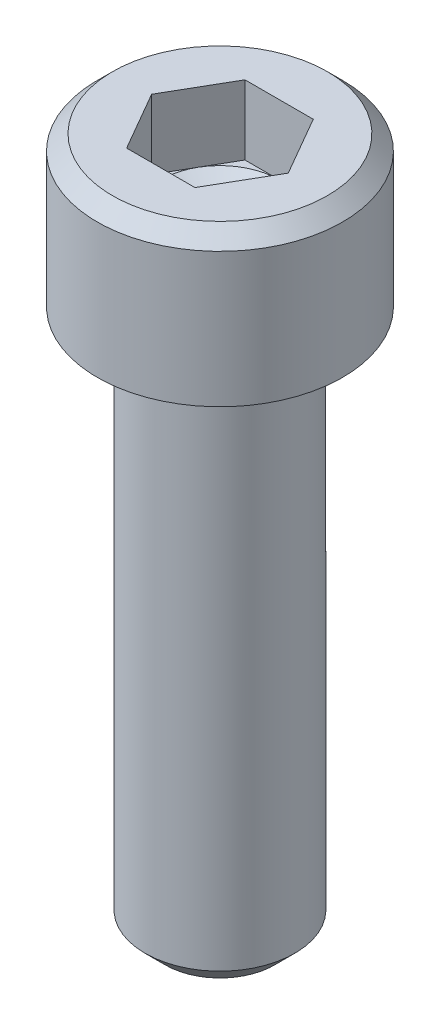
from build123d import *

# Parameters (mm, degrees)
SKETCH1_W           = 2.8702
SKETCH1_H           = 3.5052
SKETCH2_R           = 1.7526
BOSS_EXTRUDE1_DEPTH = 12.7
CUT_EXTRUDE1_DEPTH  = 1.6256
CHAMFER1_SIZE       = 0.47244
CHAMFER2_SIZE       = 0.3556
FILLET1_R           = 0.254


with BuildPart() as part:
    # Sketch1 → Revolve1 (revolve)
    with BuildSketch(Plane.XY, mode=Mode.PRIVATE) as revolve1_sk:
        with Locations((1.4351, 1.7526)):
            Rectangle(SKETCH1_W, SKETCH1_H)
    revolve(revolve1_sk.sketch.rotate(Axis((0, 3.5052, 0), (0, -1, 0)), 270), axis=Axis((0, 3.5052, 0), (0, -1, 0)))

    # Sketch2 → Boss-Extrude1 (add)
    with BuildSketch(Plane.XZ):
        with Locations(Location((0, 0, 0), (0, 0, 270))):
            Circle(SKETCH2_R)
    extrude(amount=BOSS_EXTRUDE1_DEPTH)

    # Sketch3 → Cut-Extrude1 (cut)
    with BuildSketch(Plane(origin=(0, 3.5052, 0), x_dir=(-1, 0, 0), z_dir=(0, 1, 0))):
        Polygon((-0.799225978, 1.3843), (-1.598451955, 0), (-0.799225978, -1.3843), (0.799225978, -1.3843), (1.598451955, 0), (0.799225978, 1.3843), align=None)
    extrude(amount=-CUT_EXTRUDE1_DEPTH, mode=Mode.SUBTRACT)

    # Sketch4 → Cut-Revolve1 (revolve, cut)
    with BuildSketch(Plane.XY, mode=Mode.PRIVATE) as cut_revolve1_sk:
        Polygon((1.3843, 1.8796), (0, 1.8796), (0, 1.080374022), align=None)
    revolve(cut_revolve1_sk.sketch.rotate(Axis((0, 1.879625, 0), (0, -1, 0)), 180), axis=Axis((0, 1.879625, 0), (0, -1, 0)), mode=Mode.SUBTRACT)

    # Chamfer1
    chamfer1_edges = [part.edges().sort_by_distance(p)[0] for p in [
        (0, -12.7, 1.7526),
    ]]
    chamfer(chamfer1_edges, length=CHAMFER1_SIZE)

    # Chamfer2
    chamfer2_edges = [part.edges().sort_by_distance(p)[0] for p in [
        (0, 3.5052, 2.8702),
    ]]
    chamfer(chamfer2_edges, length=CHAMFER2_SIZE)

    # Fillet1
    fillet1_edges = [part.edges().sort_by_distance(p)[0] for p in [
        (0, 0, 1.7526),
    ]]
    fillet(fillet1_edges, radius=FILLET1_R)


solid = part.part
